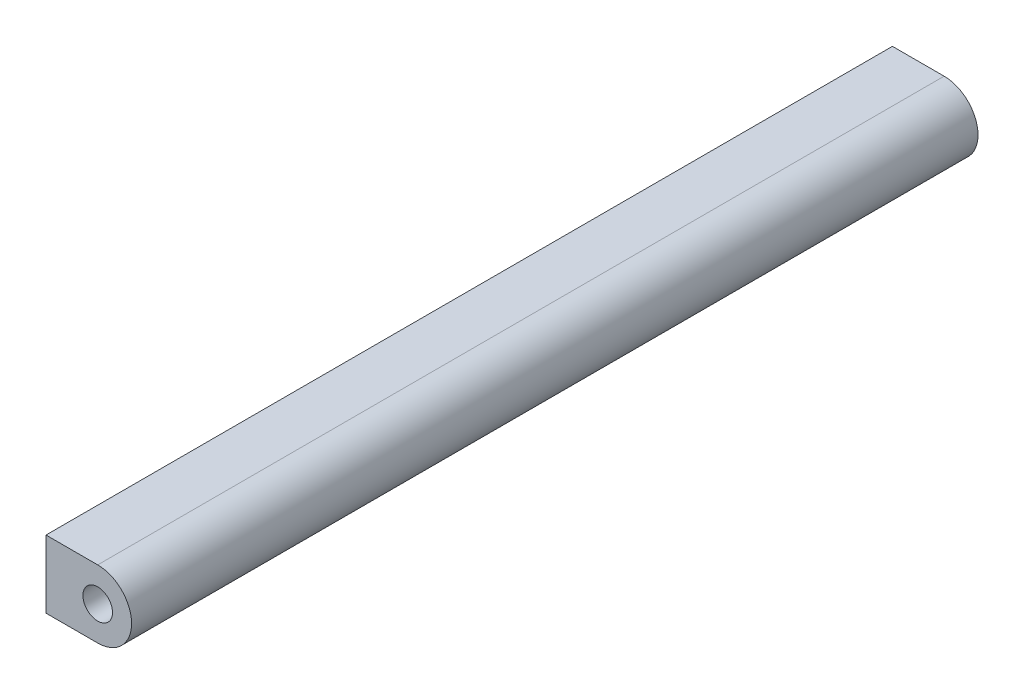
from build123d import *

# Parameters (mm, degrees)
SKETCH1_R           = 17.5
BOSS_EXTRUDE1_DEPTH = 500
SKETCH2_R           = 22.5
CUT_EXTRUDE1_DEPTH  = 30


with BuildPart() as part:
    # Sketch1 → Boss-Extrude1 (new, symmetric)
    with BuildSketch(Plane.XY):
        with BuildLine():
            Line((0, 40), (-61.093968567, 40))
            Line((-61.093968567, 40), (-61.093968567, -40))
            Line((-61.093968567, -40), (0, -40))
            ThreePointArc((0, -40), (40, 0), (0, 40))
        make_face()
        Circle(SKETCH1_R, mode=Mode.SUBTRACT)
    extrude(amount=BOSS_EXTRUDE1_DEPTH, both=True)

    # Sketch2 → Cut-Extrude1 (cut)
    with BuildSketch(Plane.ZY.offset(61.093968567)):
        with Locations(Location((0, 0, 0), (0, 0, 270))):
            Circle(SKETCH2_R)
    extrude(amount=-CUT_EXTRUDE1_DEPTH, mode=Mode.SUBTRACT)


solid = part.part
